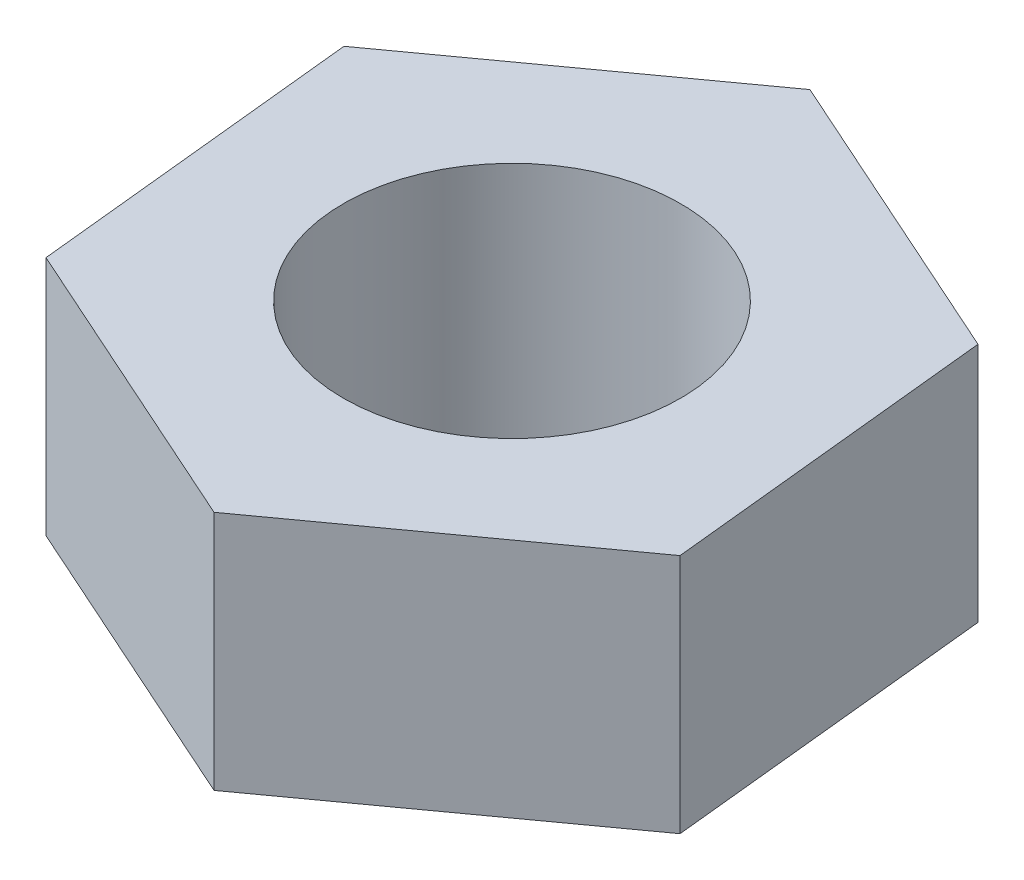
from build123d import *

# Parameters (mm, degrees)
SKETCH1_R           = 7
BOSS_EXTRUDE1_DEPTH = 10


with BuildPart() as part:
    # Sketch1 → Boss-Extrude1 (new body)
    with BuildSketch(Plane(origin=(0, 0, 0), x_dir=(1, 0, 0), z_dir=(0, 1, 0))):
        Polygon((11.230528464, 8.116355736), (-1.413706022, 13.784100815), (-12.644234485, 5.667745079), (-11.230528464, -8.116355736), (1.413706022, -13.784100815), (12.644234485, -5.667745079), align=None)
        with Locations(Location((0, 0, 0), (0, 0, 270))):
            Circle(SKETCH1_R, mode=Mode.SUBTRACT)
    extrude(amount=BOSS_EXTRUDE1_DEPTH)


solid = part.part
